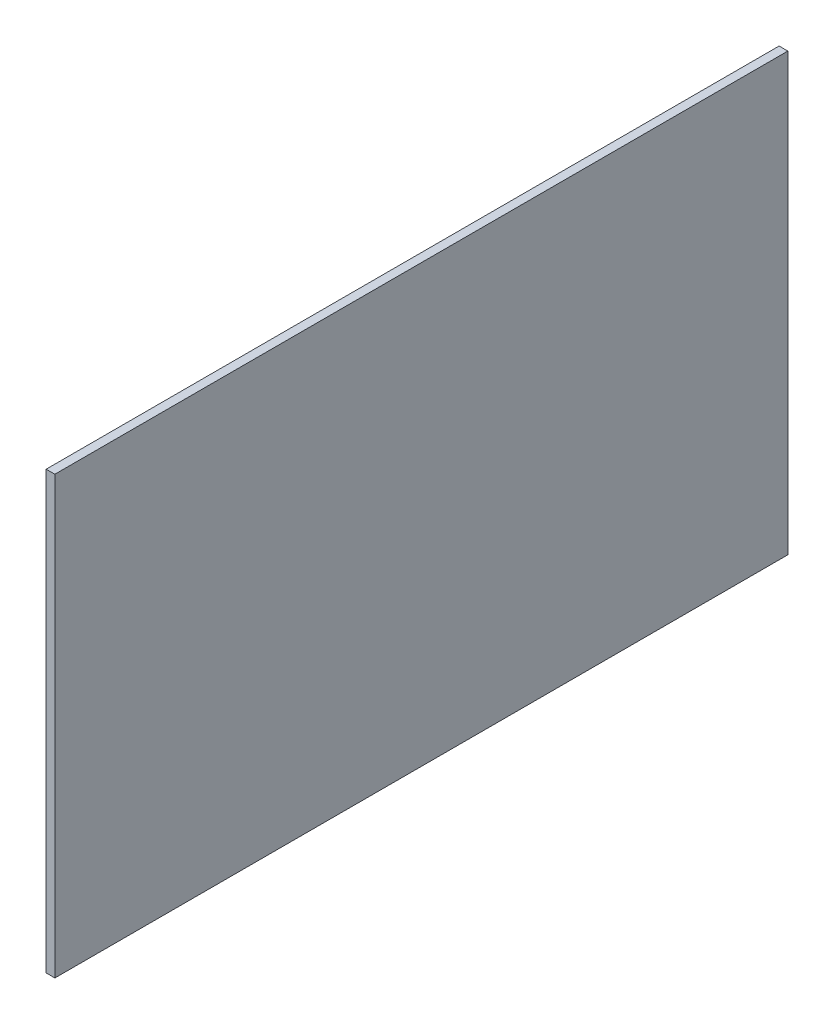
from build123d import *

# Parameters (mm, degrees)
SKETCH1_W           = 25603.2
SKETCH1_H           = 15240
BOSS_EXTRUDE1_DEPTH = 304.8


with BuildPart() as part:
    # Sketch1 → Boss-Extrude1 (new body)
    with BuildSketch(Plane(origin=(0, 0, 0), x_dir=(0, 0, -1), z_dir=(1, 0, 0))):
        with Locations((0, 635)):
            Rectangle(SKETCH1_W, SKETCH1_H)
    extrude(amount=BOSS_EXTRUDE1_DEPTH)


solid = part.part
